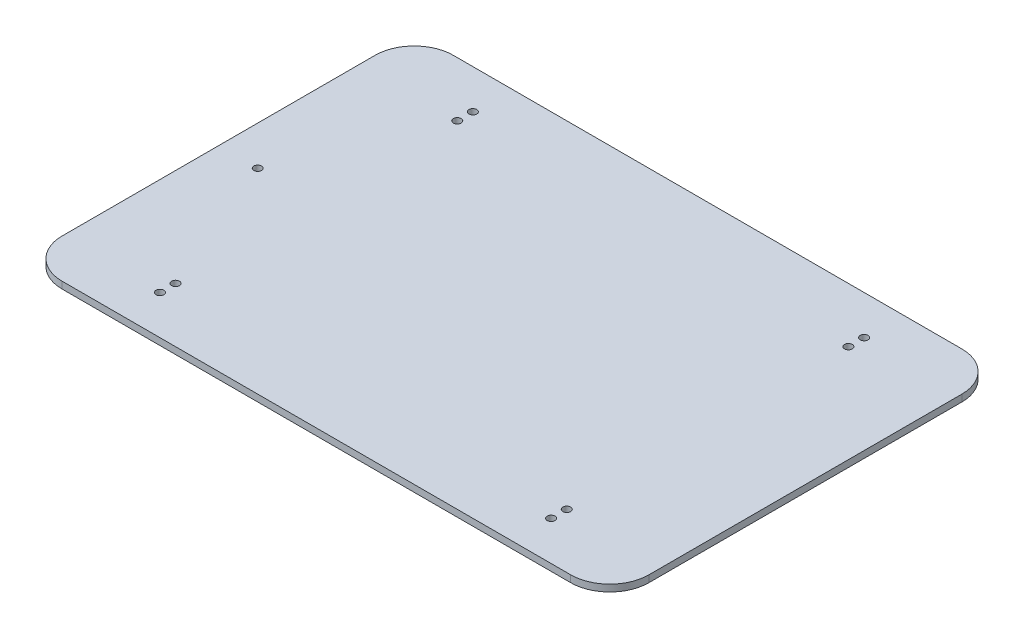
from build123d import *

# Parameters (mm, degrees)
SKETCH1_R           = 2
BOSS_EXTRUDE1_DEPTH = 3.5
SKETCH3_R           = 2
CUT_EXTRUDE2_DEPTH  = 10


with BuildPart() as part:
    # Sketch1 → Boss-Extrude1 (new body)
    with BuildSketch(Plane(origin=(0, 0, 0), x_dir=(1, 0, 0), z_dir=(0, 1, 0))):
        with BuildLine():
            Line((130, -100), (-130, -100))
            ThreePointArc((-130, -100), (-144.142135624, -94.142135624), (-150, -80))
            Line((-150, -80), (-150, 80))
            ThreePointArc((-150, 80), (-144.142135624, 94.142135624), (-130, 100))
            Line((-130, 100), (130, 100))
            ThreePointArc((130, 100), (144.142135624, 94.142135624), (150, 80))
            Line((150, 80), (150, -80))
            ThreePointArc((150, -80), (144.142135624, -94.142135624), (130, -100))
        make_face()
        with Locations(Location((-100, 80, 0), (0, 0, 270))):
            Circle(SKETCH1_R, mode=Mode.SUBTRACT)
        with Locations(Location((100, 80, 0), (0, 0, 270))):
            Circle(SKETCH1_R, mode=Mode.SUBTRACT)
        with Locations(Location((100, -80, 0), (0, 0, 270))):
            Circle(SKETCH1_R, mode=Mode.SUBTRACT)
        with Locations(Location((-100, -80, 0), (0, 0, 270))):
            Circle(SKETCH1_R, mode=Mode.SUBTRACT)
        with Locations(Location((-130, 0, 0), (0, 0, 270))):
            Circle(SKETCH1_R, mode=Mode.SUBTRACT)
    extrude(amount=BOSS_EXTRUDE1_DEPTH)

    # Sketch3 → Cut-Extrude2 (cut)
    with BuildSketch(Plane(origin=(0, 3.5, 0), x_dir=(1, 0, 0), z_dir=(0, 1, 0))):
        with Locations(Location((-100, 72, 0), (0, 0, 270))):
            Circle(SKETCH3_R)
        with Locations(Location((-100, -72, 0), (0, 0, 270))):
            Circle(SKETCH3_R)
        with Locations(Location((100, -72, 0), (0, 0, 270))):
            Circle(SKETCH3_R)
        with Locations(Location((100, 72, 0), (0, 0, 270))):
            Circle(SKETCH3_R)
    extrude(amount=-CUT_EXTRUDE2_DEPTH, mode=Mode.SUBTRACT)


solid = part.part
